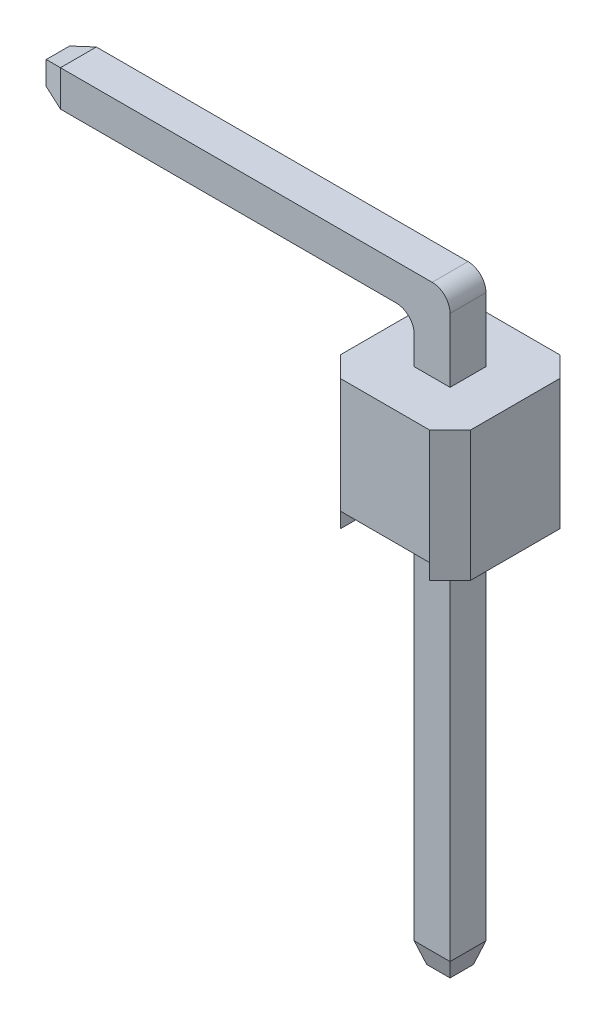
from build123d import *
from OCP.BRepFilletAPI import BRepFilletAPI_MakeChamfer

# Parameters (mm, degrees)
SKETCH1_W           = 2.54
SKETCH1_H           = 2.54
BOSS_EXTRUDE1_DEPTH = 2.54
CHAMFER1_SIZE       = 0.4
SKETCH2_W           = 1.74
SKETCH2_H           = 2.54
CUT_EXTRUDE1_DEPTH  = 0.3
SKETCH3_W           = 0.7
SKETCH3_H           = 0.7
BOSS_EXTRUDE2_DEPTH = 1.6
SKETCH5_W           = 0.7
SKETCH5_H           = 0.7
BOSS_EXTRUDE4_DEPTH = 7.3
SKETCH4_W           = 0.7
SKETCH4_H           = 0.7
BOSS_EXTRUDE3_DEPTH = 7.86
CHAMFER2_SIZE       = 0.4
CHAMFER2_SIZE2      = 0.122292273
FILLET1_R           = 0.35


with BuildPart() as part:
    # Sketch1 → Boss-Extrude1 (new body)
    with BuildSketch(Plane(origin=(0, 0, 0), x_dir=(1, 0, 0), z_dir=(0, 1, 0))):
        Rectangle(SKETCH1_W, SKETCH1_H)
    extrude(amount=BOSS_EXTRUDE1_DEPTH)

    # Chamfer1
    chamfer1_edges = [part.edges().sort_by_distance(p)[0] for p in [
        (1.27, 1.27, 1.27),
        (-1.27, 1.27, 1.27),
        (-1.27, 1.27, -1.27),
        (1.27, 1.27, -1.27),
    ]]
    chamfer(chamfer1_edges, length=CHAMFER1_SIZE)

    # Sketch2 → Cut-Extrude1 (cut)
    with BuildSketch(Plane.XZ):
        Rectangle(SKETCH2_W, SKETCH2_H)
    extrude(amount=-CUT_EXTRUDE1_DEPTH, mode=Mode.SUBTRACT)

    # Sketch3 → Boss-Extrude2 (add)
    with BuildSketch(Plane(origin=(0, 2.54, 0), x_dir=(1, 0, 0), z_dir=(0, 1, 0))):
        Rectangle(SKETCH3_W, SKETCH3_H)
    extrude(amount=BOSS_EXTRUDE2_DEPTH)

    # Sketch5 → Boss-Extrude4 (add)
    with BuildSketch(Plane.ZY.offset(0.35)):
        with Locations((0, 3.79)):
            Rectangle(SKETCH5_W, SKETCH5_H)
    extrude(amount=BOSS_EXTRUDE4_DEPTH)

    # Sketch4 → Boss-Extrude3 (add)
    with BuildSketch(Plane.XZ.offset(-0.3)):
        Rectangle(SKETCH4_W, SKETCH4_H)
    extrude(amount=BOSS_EXTRUDE3_DEPTH)

    # Chamfer2: one chamfer whose edges measure the first distance from different faces: ONE call of the kernel's chamfer builder (chamfer() names one face for all edges)
    chamfer2_edges_1 = [part.edges().sort_by_distance(p)[0] for p in [
        (-7.65, 3.79, -0.35),
    ]]
    chamfer2_side_1 = [part.faces().sort_by_distance(p)[0] for p in [
        (-3.280898876, 3.709101124, -0.35),
    ]]
    chamfer2_edges_2 = [part.edges().sort_by_distance(p)[0] for p in [
        (-7.65, 3.44, 0),
    ]]
    chamfer2_side_2 = [part.faces().sort_by_distance(p)[0] for p in [
        (-4, 3.44, 0),
    ]]
    chamfer2_edges_3 = [part.edges().sort_by_distance(p)[0] for p in [
        (-7.65, 3.79, 0.35),
    ]]
    chamfer2_side_3 = [part.faces().sort_by_distance(p)[0] for p in [
        (-3.280898876, 3.709101124, 0.35),
    ]]
    chamfer2_edges_4 = [part.edges().sort_by_distance(p)[0] for p in [
        (-7.65, 4.14, 0),
    ]]
    chamfer2_side_4 = [part.faces().sort_by_distance(p)[0] for p in [
        (-3.65, 4.14, 0),
    ]]
    chamfer2_edges_5 = [part.edges().sort_by_distance(p)[0] for p in [
        (0, -7.56, 0.35),
    ]]
    chamfer2_side_5 = [part.faces().sort_by_distance(p)[0] for p in [
        (0, -3.63, 0.35),
    ]]
    chamfer2_edges_6 = [part.edges().sort_by_distance(p)[0] for p in [
        (-0.35, -7.56, 0),
    ]]
    chamfer2_side_6 = [part.faces().sort_by_distance(p)[0] for p in [
        (-0.35, -3.63, 0),
    ]]
    chamfer2_edges_7 = [part.edges().sort_by_distance(p)[0] for p in [
        (0, -7.56, -0.35),
    ]]
    chamfer2_side_7 = [part.faces().sort_by_distance(p)[0] for p in [
        (0, -3.63, -0.35),
    ]]
    chamfer2_edges_8 = [part.edges().sort_by_distance(p)[0] for p in [
        (0.35, -7.56, 0),
    ]]
    chamfer2_side_8 = [part.faces().sort_by_distance(p)[0] for p in [
        (0.35, -3.63, 0),
    ]]
    chamfer2 = BRepFilletAPI_MakeChamfer(part.part.solid().wrapped)
    for e in chamfer2_edges_1:
        chamfer2.Add(CHAMFER2_SIZE, CHAMFER2_SIZE2, e.wrapped, chamfer2_side_1[0].wrapped)  # the first distance lies on this face
    for e in chamfer2_edges_2:
        chamfer2.Add(CHAMFER2_SIZE, CHAMFER2_SIZE2, e.wrapped, chamfer2_side_2[0].wrapped)  # the first distance lies on this face
    for e in chamfer2_edges_3:
        chamfer2.Add(CHAMFER2_SIZE, CHAMFER2_SIZE2, e.wrapped, chamfer2_side_3[0].wrapped)  # the first distance lies on this face
    for e in chamfer2_edges_4:
        chamfer2.Add(CHAMFER2_SIZE, CHAMFER2_SIZE2, e.wrapped, chamfer2_side_4[0].wrapped)  # the first distance lies on this face
    for e in chamfer2_edges_5:
        chamfer2.Add(CHAMFER2_SIZE, CHAMFER2_SIZE2, e.wrapped, chamfer2_side_5[0].wrapped)  # the first distance lies on this face
    for e in chamfer2_edges_6:
        chamfer2.Add(CHAMFER2_SIZE, CHAMFER2_SIZE2, e.wrapped, chamfer2_side_6[0].wrapped)  # the first distance lies on this face
    for e in chamfer2_edges_7:
        chamfer2.Add(CHAMFER2_SIZE, CHAMFER2_SIZE2, e.wrapped, chamfer2_side_7[0].wrapped)  # the first distance lies on this face
    for e in chamfer2_edges_8:
        chamfer2.Add(CHAMFER2_SIZE, CHAMFER2_SIZE2, e.wrapped, chamfer2_side_8[0].wrapped)  # the first distance lies on this face
    add(Compound.cast(chamfer2.Shape()), mode=Mode.REPLACE)

    # Fillet1
    fillet1_edges = [part.edges().sort_by_distance(p)[0] for p in [
        (0.35, 4.14, 0),
        (-0.35, 3.44, 0),
    ]]
    fillet(fillet1_edges, radius=FILLET1_R)


solid = part.part
